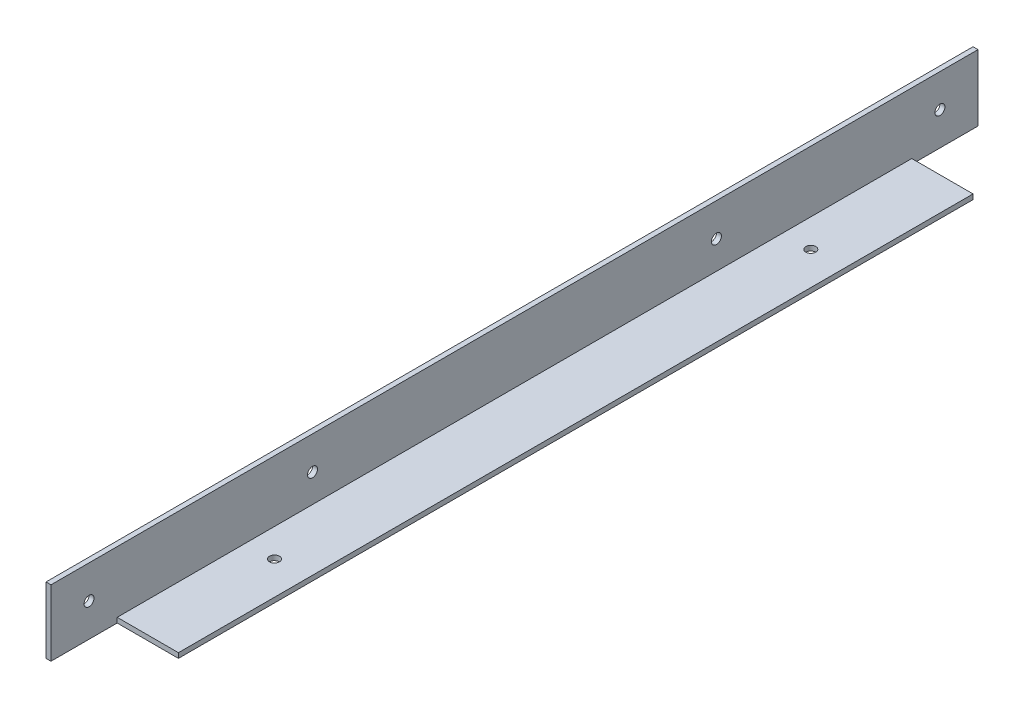
from build123d import *

# Parameters (mm, degrees)
EXTRUSION1_DEPTH = 240
ESQUISSE2_R      = 1.5
EXTRUSION2_DEPTH = 242.541404318
ESQUISSE3_W      = 1.5
ESQUISSE3_H      = 20
EXTRUSION3_DEPTH = 20
ESQUISSE5_W      = 1.5
ESQUISSE5_H      = 20
EXTRUSION4_DEPTH = 20
ESQUISSE6_R      = 1.5
EXTRUSION5_DEPTH = 262.423506977


with BuildPart() as part:
    # Esquisse1 → Extrusion1 (new body)
    with BuildSketch(Plane.XY):
        Polygon((0, 0), (20, 0), (20, 1.5), (1.5, 1.5), (1.5, 20), (0, 20), align=None)
    extrude(amount=EXTRUSION1_DEPTH)

    # Esquisse2 → Extrusion2 (cut, through all)
    with BuildSketch(Plane(origin=(0, 1.5, 0), x_dir=(1, 0, 0), z_dir=(0, 1, 0))):
        with Locations(Location((10, -39, 0), (0, 0, 180))):
            Circle(ESQUISSE2_R)
        with Locations(Location((10, -201, 0), (0, 0, 180))):
            Circle(ESQUISSE2_R)
    extrude(amount=-EXTRUSION2_DEPTH, mode=Mode.SUBTRACT)

    # Esquisse3 → Extrusion3 (add)
    with BuildSketch(Plane.XY.offset(240)):
        with Locations((0.75, 10)):
            Rectangle(ESQUISSE3_W, ESQUISSE3_H)
    extrude(amount=EXTRUSION3_DEPTH)

    # Esquisse5 → Extrusion4 (add)
    with BuildSketch(Plane(origin=(0, 0, 0), x_dir=(-1, 0, 0), z_dir=(0, 0, -1))):
        with Locations((-0.75, 10)):
            Rectangle(ESQUISSE5_W, ESQUISSE5_H)
    extrude(amount=EXTRUSION4_DEPTH)

    # Esquisse6 → Extrusion5 (cut, through all)
    with BuildSketch(Plane(origin=(1.5, 0, 0), x_dir=(0, 0, -1), z_dir=(1, 0, 0))):
        with Locations(Location((-248.5, 10, 0), (0, 0, 90))):
            Circle(ESQUISSE6_R)
        with Locations(Location((8.5, 10, 0), (0, 0, 90))):
            Circle(ESQUISSE6_R)
        with Locations(Location((-181, 10, 0), (0, 0, 90))):
            Circle(ESQUISSE6_R)
        with Locations(Location((-59, 10, 0), (0, 0, 90))):
            Circle(ESQUISSE6_R)
    extrude(amount=-EXTRUSION5_DEPTH, mode=Mode.SUBTRACT)


solid = part.part
